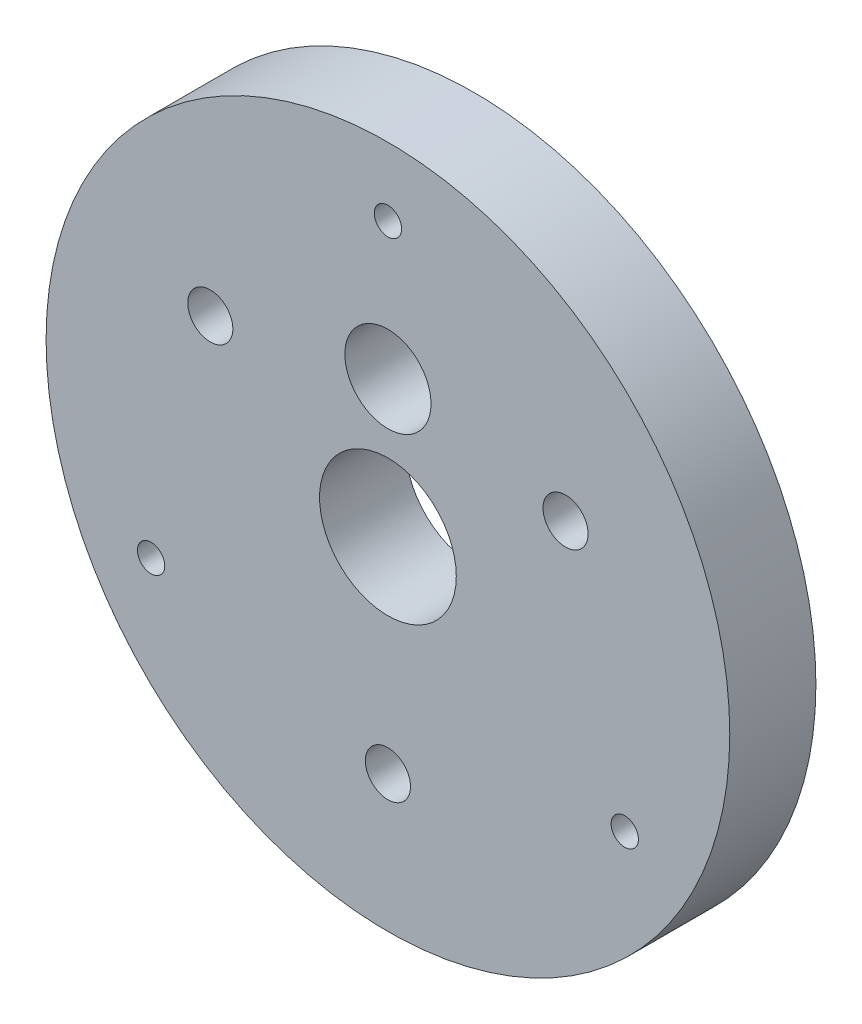
from build123d import *

# Parameters (mm, degrees)
SKETCH1_R           = 25
SKETCH1_R_2         = 5
SKETCH1_R_3         = 1
SKETCH1_R_4         = 3.15
SKETCH1_R_5         = 1.65
BOSS_EXTRUDE1_DEPTH = 6.3


with BuildPart() as part:
    # Sketch1 → Boss-Extrude1 (new body)
    with BuildSketch(Plane.XY):
        Circle(SKETCH1_R)
        Circle(SKETCH1_R_2, mode=Mode.SUBTRACT)
        with Locations((0, 20)):
            Circle(SKETCH1_R_3, mode=Mode.SUBTRACT)
        with Locations((17.320508076, -10)):
            Circle(SKETCH1_R_3, mode=Mode.SUBTRACT)
        with Locations((-17.320508076, -10)):
            Circle(SKETCH1_R_3, mode=Mode.SUBTRACT)
        with Locations((0, 10)):
            Circle(SKETCH1_R_4, mode=Mode.SUBTRACT)
        with Locations((-12.990381057, 7.5)):
            Circle(SKETCH1_R_5, mode=Mode.SUBTRACT)
        with Locations((12.990381057, 7.5)):
            Circle(SKETCH1_R_5, mode=Mode.SUBTRACT)
        with Locations((0, -15)):
            Circle(SKETCH1_R_5, mode=Mode.SUBTRACT)
    extrude(amount=BOSS_EXTRUDE1_DEPTH)


solid = part.part
